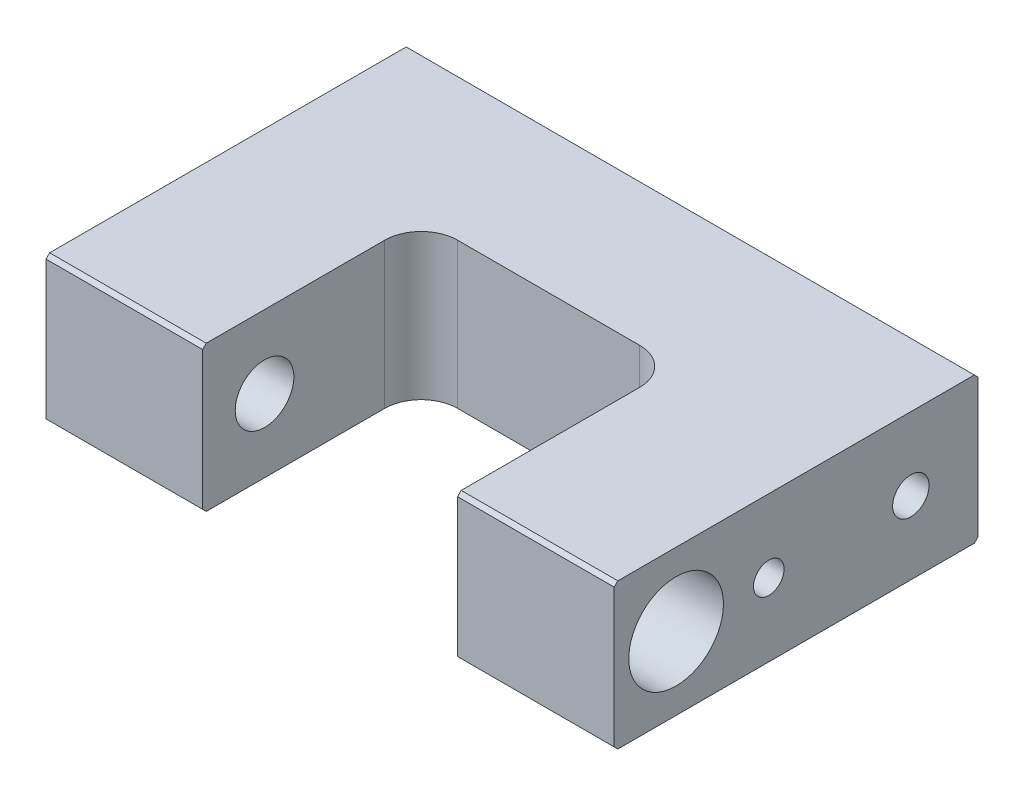
from build123d import *

# Parameters (mm, degrees)
SKETCH_1_W           = 78
SKETCH_1_H           = 54.441624366
EXTRUDE_1_DEPTH      = 20
CUT_EXTRUDE_1_DEPTH  = 52.59430798
SKETCH_3_R           = 2.5
CUT_EXTRUDE_2_DEPTH  = 15
SKETCH_4_R           = 2.1
CUT_EXTRUDE_3_DEPTH  = 10
SKETCH_5_R           = 6.5
CUT_EXTRUDE_4_DEPTH  = 12.5
SKETCH_6_R           = 4.025
CUT_EXTRUDE_5_DEPTH  = 74.696829076
CUT_EXTRUDE_START    = -12.5
SKETCH_7_R           = 6.5
CUT_EXTRUDE_6_DEPTH  = 12.5
CUT_EXTRUDE_START_2  = -15
SKETCH_11_R          = 2.5
CUT_EXTRUDE_9_DEPTH  = 15
CUT_EXTRUDE_START_3  = -10
SKETCH_12_R          = 2.1
CUT_EXTRUDE_10_DEPTH = 10
SKETCH_9_W           = 4.5
SKETCH_9_H           = 20
CUT_EXTRUDE_8_DEPTH  = 85.999838917
CHAMFER_3_SIZE       = 0.5


with BuildPart() as part:
    # 草图1 → 凸台-拉伸1 (new body)
    with BuildSketch(Plane(origin=(0, 0, 0), x_dir=(1, 0, 0), z_dir=(0, 1, 0))):
        Rectangle(SKETCH_1_W, SKETCH_1_H)
    extrude(amount=EXTRUDE_1_DEPTH)

    # 草图2 → 切除-拉伸1 (cut, through all)
    with BuildSketch(Plane(origin=(0, 20, 0), x_dir=(1, 0, 0), z_dir=(0, 1, 0))):
        with BuildLine():
            Line((-17.5, -27.220812183), (17.5, -27.220812183))
            Line((17.5, -27.220812183), (17.5, -2.220812183))
            ThreePointArc((17.5, -2.220812183), (16.035533906, 1.314721723), (12.5, 2.779187817))
            Line((12.5, 2.779187817), (-12.5, 2.779187817))
            ThreePointArc((-12.5, 2.779187817), (-16.035533906, 1.314721723), (-17.5, -2.220812183))
            Line((-17.5, -2.220812183), (-17.5, -27.220812183))
        make_face()
    extrude(amount=-CUT_EXTRUDE_1_DEPTH, mode=Mode.SUBTRACT)

    # 草图3 → 切除-拉伸2 (cut)
    with BuildSketch(Plane.ZY.offset(39)):
        with Locations((-13.5, 10)):
            Circle(SKETCH_3_R)
    extrude(amount=-CUT_EXTRUDE_2_DEPTH, mode=Mode.SUBTRACT)

    # 草图4 → 切除-拉伸3 (cut)
    with BuildSketch(Plane.ZY.offset(39)):
        with Locations((6, 10)):
            Circle(SKETCH_4_R)
    extrude(amount=-CUT_EXTRUDE_3_DEPTH, mode=Mode.SUBTRACT)

    # 草图5 → 切除-拉伸4 (cut)
    with BuildSketch(Plane.ZY.offset(39)):
        with Locations((18.720812183, 10)):
            Circle(SKETCH_5_R)
    extrude(amount=-CUT_EXTRUDE_4_DEPTH, mode=Mode.SUBTRACT)

    # 草图6 → 切除-拉伸5 (cut, through all)
    with BuildSketch(Plane.ZY.offset(26.5)):
        with Locations((18.720812183, 10)):
            Circle(SKETCH_6_R)
    extrude(amount=-CUT_EXTRUDE_5_DEPTH, mode=Mode.SUBTRACT)

    # 草图7 → 切除-拉伸6 (cut)
    with BuildSketch(Plane(origin=(39, 0, 0), x_dir=(0, 0, -1), z_dir=(1, 0, 0)).offset(CUT_EXTRUDE_START)):
        with Locations(Location((-18.720812183, 10, 0), (0, 0, 180))):
            Circle(SKETCH_7_R)
    extrude(amount=CUT_EXTRUDE_6_DEPTH, mode=Mode.SUBTRACT)

    # 草图11 → 切除-拉伸9 (cut)
    with BuildSketch(Plane(origin=(39, 0, 0), x_dir=(0, 0, -1), z_dir=(1, 0, 0)).offset(CUT_EXTRUDE_START_2)):
        with Locations(Location((13.5, 10, 0), (0, 0, 180))):
            Circle(SKETCH_11_R)
    extrude(amount=CUT_EXTRUDE_9_DEPTH, mode=Mode.SUBTRACT)

    # 草图12 → 切除-拉伸10 (cut)
    with BuildSketch(Plane(origin=(39, 0, 0), x_dir=(0, 0, -1), z_dir=(1, 0, 0)).offset(CUT_EXTRUDE_START_3)):
        with Locations(Location((-6, 10, 0), (0, 0, 180))):
            Circle(SKETCH_12_R)
    extrude(amount=CUT_EXTRUDE_10_DEPTH, mode=Mode.SUBTRACT)

    # 草图9 → 切除-拉伸8 (cut, through all)
    with BuildSketch(Plane.ZY.offset(39)):
        with Locations((-24.970812183, 10)):
            Rectangle(SKETCH_9_W, SKETCH_9_H)
    extrude(amount=-CUT_EXTRUDE_8_DEPTH, mode=Mode.SUBTRACT)

    # 倒角3
    chamfer_3_edges = [part.edges().sort_by_distance(p)[0] for p in [
        (28.25, 0, 27.220812183),
        (-28.25, 20, 27.220812183),
        (28.25, 20, 27.220812183),
        (-28.25, 0, 27.220812183),
        (0, 20, -22.720812183),
        (0, 0, -22.720812183),
    ]]
    chamfer(chamfer_3_edges, length=CHAMFER_3_SIZE)


solid = part.part
